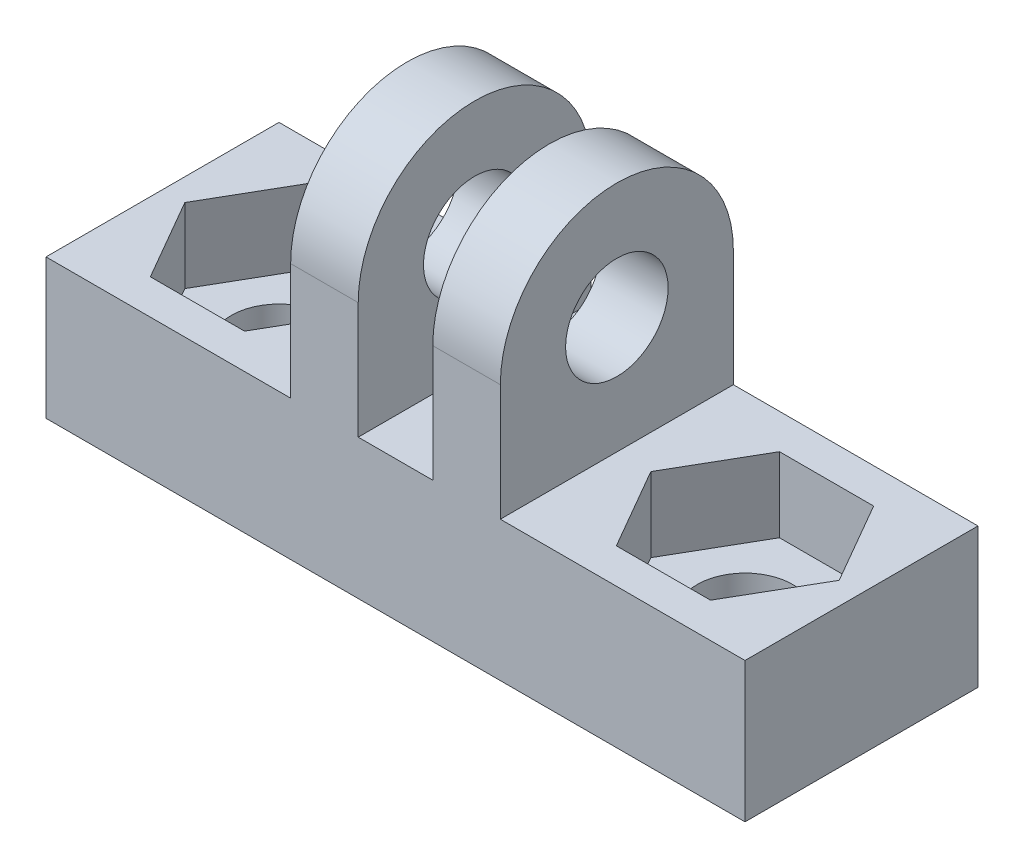
from build123d import *

# Parameters (mm, degrees)
SKETCH1_W           = 10
SKETCH1_H           = 10
SKETCH1_R           = 2.05
BOSS_EXTRUDE1_DEPTH = 6
CUT_EXTRUDE1_DEPTH  = 3.2
SKETCH3_W           = 10
SKETCH3_H           = 6
BOSS_EXTRUDE2_DEPTH = 20
SKETCH4_R           = 2.05
CUT_EXTRUDE2_DEPTH  = 27.191601707
CUT_EXTRUDE3_DEPTH  = 3.2
SKETCH6_R           = 2.2
BOSS_EXTRUDE3_DEPTH = 4.5
SKETCH7_W           = 10
SKETCH7_H           = 10.114722763
CUT_EXTRUDE4_DEPTH  = 1.6


with BuildPart() as part:
    # Sketch1 → Boss-Extrude1 (new body)
    with BuildSketch(Plane(origin=(0, 0, 0), x_dir=(1, 0, 0), z_dir=(0, 1, 0))):
        Rectangle(SKETCH1_W, SKETCH1_H)
        with Locations(Location((0, 0, 0), (0, 0, 270))):
            Circle(SKETCH1_R, mode=Mode.SUBTRACT)
    extrude(amount=BOSS_EXTRUDE1_DEPTH)

    # Sketch2 → Cut-Extrude1 (cut)
    with BuildSketch(Plane(origin=(0, 6, 0), x_dir=(1, 0, 0), z_dir=(0, 1, 0))):
        Polygon((4.041451884, 0), (2.020725942, 3.5), (-2.020725942, 3.5), (-4.041451884, 0), (-2.020725942, -3.5), (2.020725942, -3.5), align=None)
    extrude(amount=-CUT_EXTRUDE1_DEPTH, mode=Mode.SUBTRACT)

    # Sketch3 → Boss-Extrude2 (add)
    with BuildSketch(Plane(origin=(5, 0, 0), x_dir=(0, 0, -1), z_dir=(1, 0, 0))):
        with Locations((0, 3)):
            Rectangle(SKETCH3_W, SKETCH3_H)
    extrude(amount=BOSS_EXTRUDE2_DEPTH)

    # Sketch4 → Cut-Extrude2 (cut, through all)
    with BuildSketch(Plane(origin=(0, 6, 0), x_dir=(1, 0, 0), z_dir=(0, 1, 0))):
        with Locations(Location((20, 0, 0), (0, 0, 270))):
            Circle(SKETCH4_R)
    extrude(amount=-CUT_EXTRUDE2_DEPTH, mode=Mode.SUBTRACT)

    # Sketch5 → Cut-Extrude3 (cut)
    with BuildSketch(Plane(origin=(0, 6, 0), x_dir=(1, 0, 0), z_dir=(0, 1, 0))):
        Polygon((24.041451884, 0), (22.020725942, 3.5), (17.979274058, 3.5), (15.958548116, 0), (17.979274058, -3.5), (22.020725942, -3.5), align=None)
    extrude(amount=-CUT_EXTRUDE3_DEPTH, mode=Mode.SUBTRACT)

    # Sketch6 → Boss-Extrude3 (add, symmetric)
    with BuildSketch(Plane.ZY.offset(-10)):
        with BuildLine():
            Line((5, 6), (5, 11))
            ThreePointArc((5, 11), (0, 16), (-5, 11))
            Line((-5, 11), (-5, 6))
            Line((-5, 6), (5, 6))
        make_face()
        with Locations((0, 11)):
            Circle(SKETCH6_R, mode=Mode.SUBTRACT)
    extrude(amount=BOSS_EXTRUDE3_DEPTH, both=True)

    # Sketch7 → Cut-Extrude4 (cut, symmetric)
    with BuildSketch(Plane.ZY.offset(-10)):
        with Locations((0, 11.057361381)):
            Rectangle(SKETCH7_W, SKETCH7_H)
    extrude(amount=CUT_EXTRUDE4_DEPTH, both=True, mode=Mode.SUBTRACT)


solid = part.part
